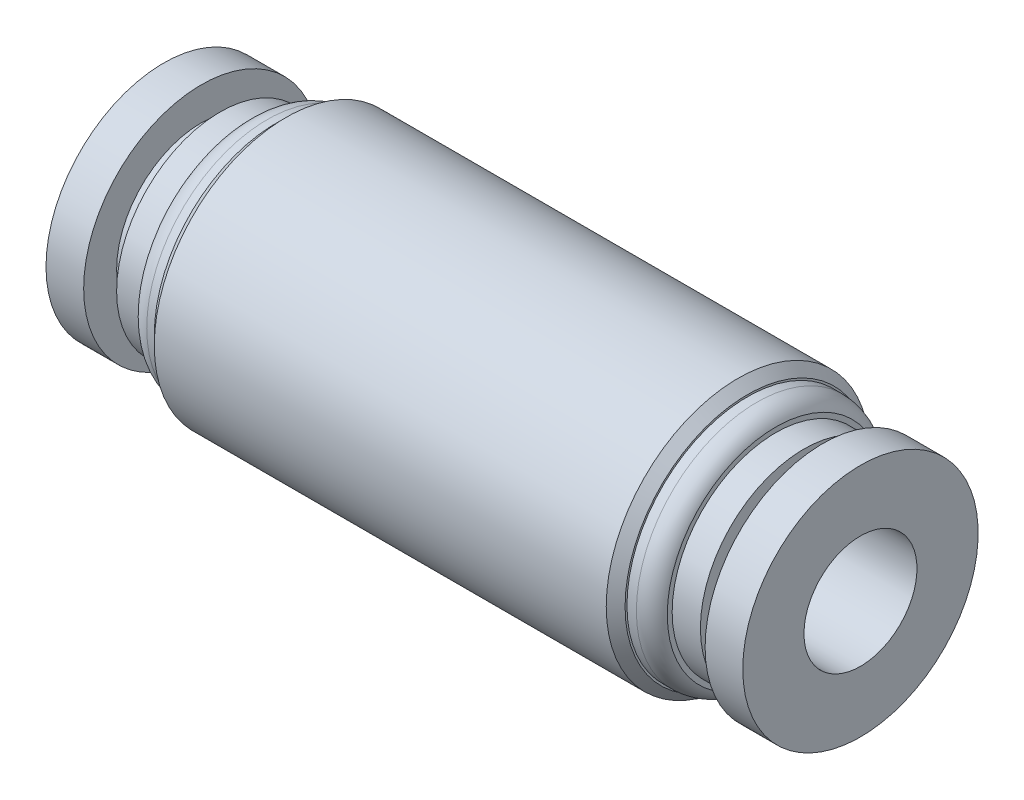
from build123d import *

# Parameters (mm, degrees)
CHAMFER_1_SIZE = 0.5


with BuildPart() as part:
    # 草图1 → 旋转1 (revolve)
    with BuildSketch(Plane(origin=(0, 0, 0), x_dir=(1, 0, 0), z_dir=(0, 1, 0)), mode=Mode.PRIVATE) as revolve_1_sk:
        with BuildLine():
            Line((-12.5, 7), (12.5, 7))
            Line((12.5, 7), (12.5, 6.4))
            Line((12.5, 6.4), (13, 6.4))
            ThreePointArc((13, 6.4), (13.594102968, 6.225765447), (14, 5.758257569))
            Line((14, 5.758257569), (14, 5.5))
            Line((14, 5.5), (15.5, 5.5))
            Line((15.5, 5.5), (15.5, 4.5))
            Line((15.5, 4.5), (16.5, 4.5))
            Line((16.5, 4.5), (16.5, 6.25))
            Line((16.5, 6.25), (18.5, 6.25))
            Line((18.5, 6.25), (18.5, 3))
            Line((18.5, 3), (-18.5, 3))
            Line((-18.5, 3), (-18.5, 6.25))
            Line((-18.5, 6.25), (-16.5, 6.25))
            Line((-16.5, 6.25), (-16.5, 4.5))
            Line((-16.5, 4.5), (-15.5, 4.5))
            Line((-15.5, 4.5), (-15.5, 5.5))
            Line((-15.5, 5.5), (-14, 5.5))
            Line((-14, 5.5), (-14, 5.758257569))
            ThreePointArc((-14, 5.758257569), (-13.594102968, 6.225765447), (-13, 6.4))
            Line((-13, 6.4), (-12.5, 6.4))
            Line((-12.5, 6.4), (-12.5, 7))
        make_face()
    revolve(revolve_1_sk.sketch.rotate(Axis((-37.377186512, 0, 0), (1, 0, 0)), 180), axis=Axis((-37.377186512, 0, 0), (1, 0, 0)))

    # 倒角1
    chamfer_1_edges = [part.edges().sort_by_distance(p)[0] for p in [
        (-12.5, 0, -7),
        (12.5, 0, -7),
    ]]
    chamfer(chamfer_1_edges, length=CHAMFER_1_SIZE)


solid = part.part
